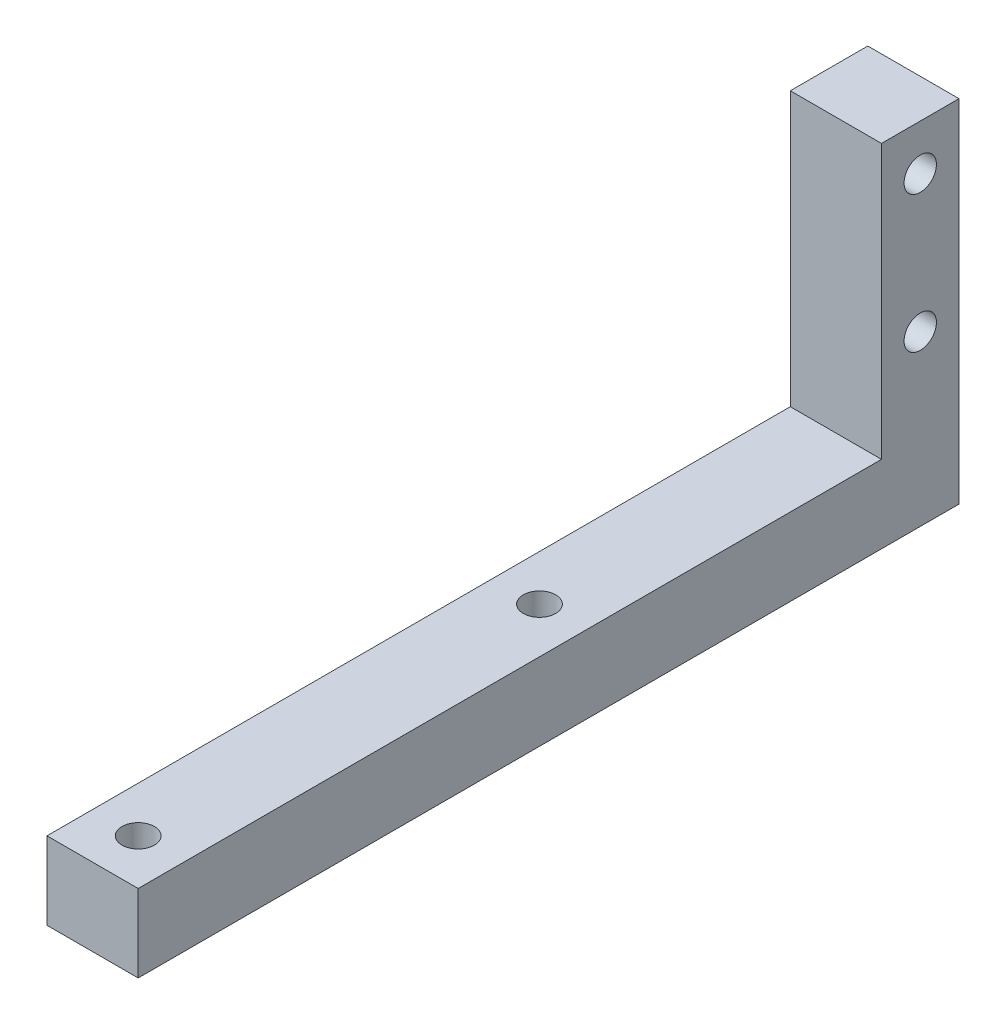
from build123d import *

# Parameters (mm, degrees)
SKETCH1_R           = 1.775
BOSS_EXTRUDE1_DEPTH = 10
SKETCH2_R           = 1.775
CUT_EXTRUDE1_DEPTH  = 65.392818275


with BuildPart() as part:
    # Sketch1 → Boss-Extrude1 (new body)
    with BuildSketch(Plane(origin=(0, 0, 0), x_dir=(0, 0, -1), z_dir=(1, 0, 0))):
        Polygon((-56.093092672, 4.635278297), (25.406907328, 4.635278297), (25.406907328, 34.635278297), (33.906907328, 34.635278297), (33.906907328, -3.864721703), (-56.093092672, -3.864721703), align=None)
        with Locations((29.656907328, 14.635278297)):
            Circle(SKETCH1_R, mode=Mode.SUBTRACT)
        with Locations((29.656907328, 29.635278297)):
            Circle(SKETCH1_R, mode=Mode.SUBTRACT)
    extrude(amount=BOSS_EXTRUDE1_DEPTH)

    # Sketch2 → Cut-Extrude1 (cut, through all)
    with BuildSketch(Plane(origin=(0, 4.635278297, 0), x_dir=(1, 0, 0), z_dir=(0, 1, 0))):
        with Locations(Location((5, -51.093092672, 0), (0, 0, 270))):
            Circle(SKETCH2_R)
        with Locations(Location((5, -7.093092672, 0), (0, 0, 270))):
            Circle(SKETCH2_R)
    extrude(amount=-CUT_EXTRUDE1_DEPTH, mode=Mode.SUBTRACT)


solid = part.part
